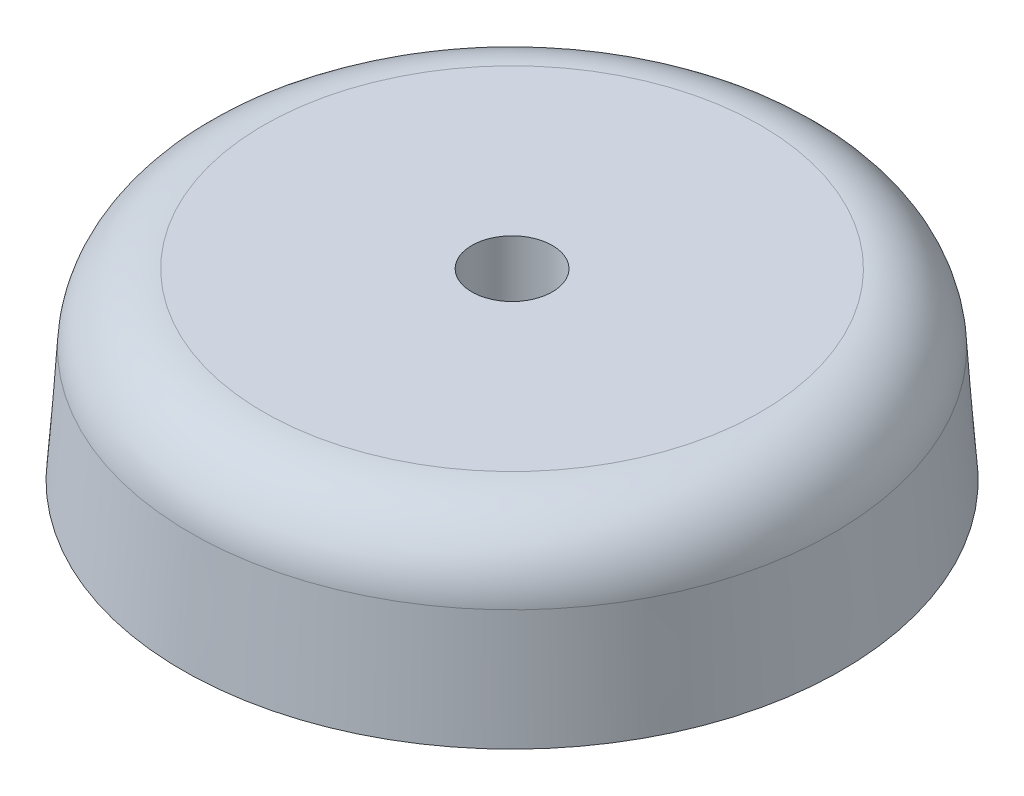
from build123d import *


with BuildPart() as part:
    # Sketch1 → Revolve1 (revolve)
    with BuildSketch(Plane.XY, mode=Mode.PRIVATE) as revolve1_sk:
        with BuildLine():
            Line((6.785335768, 5), (1.1, 5))
            Line((1.1, 5), (1.1, 2.8))
            Line((1.1, 2.8), (6.604204927, 2.8))
            Line((6.604204927, 2.8), (6.8, 0))
            Line((6.8, 0), (9, 0))
            Line((9, 0), (8.780463869, 3.139512947))
            ThreePointArc((8.780463869, 3.139512947), (8.149332488, 4.462707403), (6.785335768, 5))
        make_face()
    revolve(revolve1_sk.sketch.rotate(Axis((0, 0, 0), (0, 1, 0)), 90), axis=Axis((0, 0, 0), (0, 1, 0)))


solid = part.part
